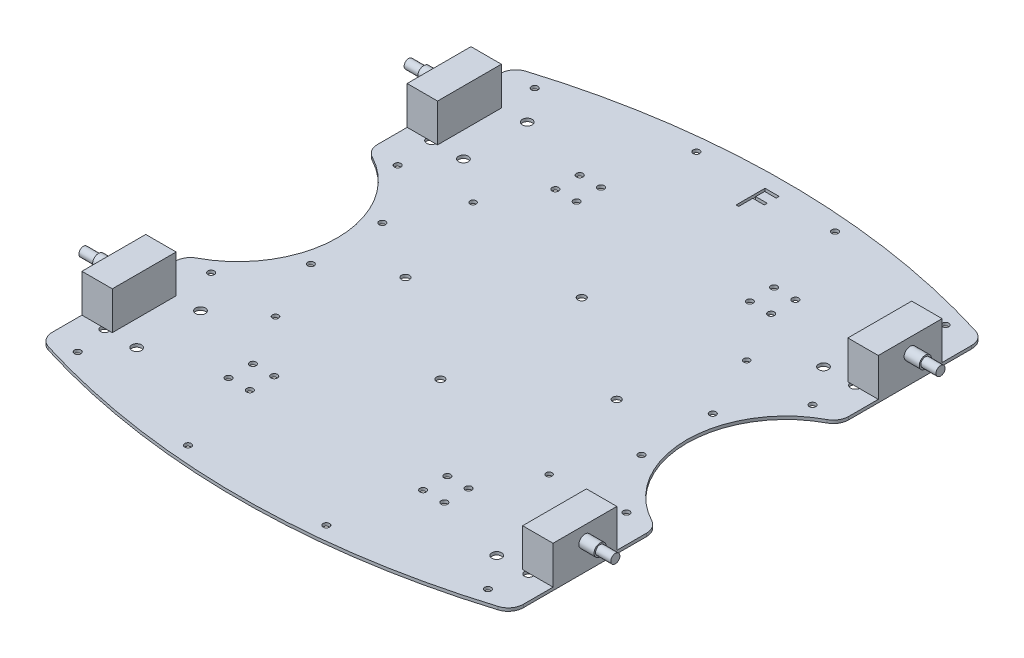
from build123d import *

# Parameters (mm, degrees)
SKETCH1_R           = 2.75
SKETCH1_R_2         = 3.19965974
SKETCH1_R_3         = 2.125
SKETCH1_R_4         = 2.6
SKETCH1_R_5         = 2
BOSS_EXTRUDE1_DEPTH = 2
CUT_EXTRUDE1_DEPTH  = 238.125138886
SKETCH3_R           = 2.125
CUT_EXTRUDE2_DEPTH  = 238.125138886
SKETCH5_W           = 42
SKETCH5_H           = 25
BOSS_EXTRUDE2_DEPTH = 20
BOSS_EXTRUDE3_START = -310
SKETCH5_2_W         = 42
SKETCH5_2_H         = 25
BOSS_EXTRUDE3_DEPTH = 20
SKETCH6_R           = 4
BOSS_EXTRUDE4_DEPTH = 10
SKETCH7_R           = 3
BOSS_EXTRUDE5_DEPTH = 10


with BuildPart() as part:
    # Sketch1 → Boss-Extrude1 (new body)
    with BuildSketch(Plane(origin=(0, 0, 0), x_dir=(1, 0, 0), z_dir=(0, 1, 0))):
        with BuildLine():
            Line((-155, 147.496205723), (-155, 66.522508221))
            ThreePointArc((-155, 66.522508221), (-153.570009292, 61.369359597), (-149.689011853, 57.690001904))
            ThreePointArc((-149.689011853, 57.690001904), (-115, 0), (-149.689011853, -57.690001904))
            ThreePointArc((-149.689011853, -57.690001904), (-153.570009292, -61.369359597), (-155, -66.522508221))
            Line((-155, -66.522508221), (-155, -147.496205723))
            ThreePointArc((-155, -147.496205723), (-153.049591193, -153.429508482), (-147.959183673, -157.048338049))
            ThreePointArc((-147.959183673, -157.048338049), (0, -179.441721715), (147.959183673, -157.048338049))
            ThreePointArc((147.959183673, -157.048338049), (153.049591193, -153.429508482), (155, -147.496205723))
            Line((155, -147.496205723), (155, -66.522508221))
            ThreePointArc((155, -66.522508221), (153.570009292, -61.369359597), (149.689011853, -57.690001904))
            ThreePointArc((149.689011853, -57.690001904), (115, 0), (149.689011853, 57.690001904))
            ThreePointArc((149.689011853, 57.690001904), (153.570009292, 61.369359597), (155, 66.522508221))
            Line((155, 66.522508221), (155, 147.496205723))
            ThreePointArc((155, 147.496205723), (153.049591193, 153.429508482), (147.959183673, 157.048338049))
            ThreePointArc((147.959183673, 157.048338049), (0, 179.441721715), (-147.959183673, 157.048338049))
            ThreePointArc((-147.959183673, 157.048338049), (-153.049591193, 153.429508482), (-155, 147.496205723))
        make_face()
        with Locations(Location((-139.47, 128.51, 0), (0, 0, 270))):
            Circle(SKETCH1_R, mode=Mode.SUBTRACT)
        with Locations(Location((-139.47, 86.51, 0), (0, 0, 270))):
            Circle(SKETCH1_R_2, mode=Mode.SUBTRACT)
        with Locations(Location((139.47, 86.51, 0), (0, 0, 270))):
            Circle(SKETCH1_R_2, mode=Mode.SUBTRACT)
        with Locations(Location((139.47, 128.51, 0), (0, 0, 270))):
            Circle(SKETCH1_R, mode=Mode.SUBTRACT)
        with Locations(Location((139.47, -86.51, 0), (0, 0, 270))):
            Circle(SKETCH1_R_2, mode=Mode.SUBTRACT)
        with Locations(Location((139.47, -128.51, 0), (0, 0, 270))):
            Circle(SKETCH1_R, mode=Mode.SUBTRACT)
        with Locations(Location((-139.47, -86.51, 0), (0, 0, 270))):
            Circle(SKETCH1_R_2, mode=Mode.SUBTRACT)
        with Locations(Location((-139.47, -128.51, 0), (0, 0, 270))):
            Circle(SKETCH1_R, mode=Mode.SUBTRACT)
        with Locations(Location((-70.97, 115.51, 0), (0, 0, 270))):
            Circle(SKETCH1_R_3, mode=Mode.SUBTRACT)
        with Locations(Location((-56.97, 115.51, 0), (0, 0, 270))):
            Circle(SKETCH1_R_3, mode=Mode.SUBTRACT)
        with Locations(Location((-70.97, 99.51, 0), (0, 0, 270))):
            Circle(SKETCH1_R_3, mode=Mode.SUBTRACT)
        with Locations(Location((-56.97, 99.51, 0), (0, 0, 270))):
            Circle(SKETCH1_R_3, mode=Mode.SUBTRACT)
        with Locations(Location((56.97, 99.51, 0), (0, 0, 270))):
            Circle(SKETCH1_R_3, mode=Mode.SUBTRACT)
        with Locations(Location((70.97, 99.51, 0), (0, 0, 270))):
            Circle(SKETCH1_R_3, mode=Mode.SUBTRACT)
        with Locations(Location((56.97, 115.51, 0), (0, 0, 270))):
            Circle(SKETCH1_R_3, mode=Mode.SUBTRACT)
        with Locations(Location((70.97, 115.51, 0), (0, 0, 270))):
            Circle(SKETCH1_R_3, mode=Mode.SUBTRACT)
        with Locations(Location((70.97, -99.51, 0), (0, 0, 270))):
            Circle(SKETCH1_R_3, mode=Mode.SUBTRACT)
        with Locations(Location((56.97, -99.51, 0), (0, 0, 270))):
            Circle(SKETCH1_R_3, mode=Mode.SUBTRACT)
        with Locations(Location((70.97, -115.51, 0), (0, 0, 270))):
            Circle(SKETCH1_R_3, mode=Mode.SUBTRACT)
        with Locations(Location((56.97, -115.51, 0), (0, 0, 270))):
            Circle(SKETCH1_R_3, mode=Mode.SUBTRACT)
        with Locations(Location((-56.97, -99.51, 0), (0, 0, 270))):
            Circle(SKETCH1_R_3, mode=Mode.SUBTRACT)
        with Locations(Location((-70.97, -99.51, 0), (0, 0, 270))):
            Circle(SKETCH1_R_3, mode=Mode.SUBTRACT)
        with Locations(Location((-56.97, -115.51, 0), (0, 0, 270))):
            Circle(SKETCH1_R_3, mode=Mode.SUBTRACT)
        with Locations(Location((-70.97, -115.51, 0), (0, 0, 270))):
            Circle(SKETCH1_R_3, mode=Mode.SUBTRACT)
        with Locations(Location((-118.47, 128.51, 0), (0, 0, 270))):
            Circle(SKETCH1_R_2, mode=Mode.SUBTRACT)
        with Locations(Location((-118.47, 86.51, 0), (0, 0, 270))):
            Circle(SKETCH1_R_2, mode=Mode.SUBTRACT)
        with Locations(Location((118.47, 86.51, 0), (0, 0, 270))):
            Circle(SKETCH1_R_2, mode=Mode.SUBTRACT)
        with Locations(Location((118.47, 128.51, 0), (0, 0, 270))):
            Circle(SKETCH1_R_2, mode=Mode.SUBTRACT)
        with Locations(Location((118.47, -128.51, 0), (0, 0, 270))):
            Circle(SKETCH1_R_2, mode=Mode.SUBTRACT)
        with Locations(Location((118.47, -86.51, 0), (0, 0, 270))):
            Circle(SKETCH1_R_2, mode=Mode.SUBTRACT)
        with Locations(Location((-118.47, -86.51, 0), (0, 0, 270))):
            Circle(SKETCH1_R_2, mode=Mode.SUBTRACT)
        with Locations(Location((-118.47, -128.51, 0), (0, 0, 270))):
            Circle(SKETCH1_R_2, mode=Mode.SUBTRACT)
        with Locations(Location((-0.51, 46.4, 0), (0, 0, 270))):
            Circle(SKETCH1_R_4, mode=Mode.SUBTRACT)
        with Locations(Location((68.99, -0.1, 0), (0, 0, 270))):
            Circle(SKETCH1_R_4, mode=Mode.SUBTRACT)
        with Locations(Location((-0.51, -46.6, 0), (0, 0, 270))):
            Circle(SKETCH1_R_4, mode=Mode.SUBTRACT)
        with Locations(Location((-70.01, -0.1, 0), (0, 0, 270))):
            Circle(SKETCH1_R_4, mode=Mode.SUBTRACT)
        with Locations(Location((-90.51, 64.9, 0), (0, 0, 270))):
            Circle(SKETCH1_R_5, mode=Mode.SUBTRACT)
        with Locations(Location((89.49, 64.9, 0), (0, 0, 270))):
            Circle(SKETCH1_R_5, mode=Mode.SUBTRACT)
        with Locations(Location((89.49, -65.1, 0), (0, 0, 270))):
            Circle(SKETCH1_R_5, mode=Mode.SUBTRACT)
        with Locations(Location((-90.51, -65.1, 0), (0, 0, 270))):
            Circle(SKETCH1_R_5, mode=Mode.SUBTRACT)
    extrude(amount=BOSS_EXTRUDE1_DEPTH)

    # Sketch2 → Cut-Extrude1 (cut, through all)
    with BuildSketch(Plane(origin=(0, 2, 0), x_dir=(1, 0, 0), z_dir=(0, 1, 0))):
        Polygon((-2.557692308, 169.05), (6.723076923, 169.05), (6.723076923, 167.096153846), (-0.848076923, 167.096153846), (-0.848076923, 161.234615385), (6.723076923, 161.234615385), (6.723076923, 159.280769231), (-0.848076923, 159.280769231), (-0.848076923, 150), (-2.557692308, 150), align=None)
    extrude(amount=-CUT_EXTRUDE1_DEPTH, mode=Mode.SUBTRACT)

    # Sketch3 → Cut-Extrude2 (cut, through all)
    with BuildSketch(Plane(origin=(0, 2, 0), x_dir=(1, 0, 0), z_dir=(0, 1, 0))):
        with Locations(Location((-135.418169234, 150.357764594, 0), (0, 0, 270))):
            Circle(SKETCH3_R)
        with Locations(Location((-45.914062128, 167.285855531, 0), (0, 0, 270))):
            Circle(SKETCH3_R)
        with Locations(Location((45.176775579, 167.354684187, 0), (0, 0, 270))):
            Circle(SKETCH3_R)
        with Locations(Location((134.706362354, 150.561871932, 0), (0, 0, 270))):
            Circle(SKETCH3_R)
        with Locations(Location((134.706362354, -150.561871932, 0), (0, 0, 90))):
            Circle(SKETCH3_R)
        with Locations(Location((45.176775579, -167.354684187, 0), (0, 0, 90))):
            Circle(SKETCH3_R)
        with Locations(Location((-45.914062128, -167.285855531, 0), (0, 0, 90))):
            Circle(SKETCH3_R)
        with Locations(Location((-135.418169234, -150.357764594, 0), (0, 0, 90))):
            Circle(SKETCH3_R)
        with Locations(Location((-136.498269922, 61.257473969, 0), (0, 0, 270))):
            Circle(SKETCH3_R)
        with Locations(Location((-108.723114922, 23.387075934, 0), (0, 0, 270))):
            Circle(SKETCH3_R)
        with Locations(Location((-108.785429276, -23.5769784, 0), (0, 0, 270))):
            Circle(SKETCH3_R)
        with Locations(Location((-136.660983133, -61.373536175, 0), (0, 0, 270))):
            Circle(SKETCH3_R)
        with Locations(Location((136.660983133, -61.373536175, 0), (0, 0, 90))):
            Circle(SKETCH3_R)
        with Locations(Location((108.785429276, -23.5769784, 0), (0, 0, 90))):
            Circle(SKETCH3_R)
        with Locations(Location((108.723114922, 23.387075934, 0), (0, 0, 90))):
            Circle(SKETCH3_R)
        with Locations(Location((136.498269922, 61.257473969, 0), (0, 0, 90))):
            Circle(SKETCH3_R)
    extrude(amount=-CUT_EXTRUDE2_DEPTH, mode=Mode.SUBTRACT)

    # Sketch5 → Boss-Extrude2 (add)
    with BuildSketch(Plane.ZY.offset(155)):
        with Locations((-107.009356972, 14.5)):
            Rectangle(SKETCH5_W, SKETCH5_H)
        with Locations((107.009356972, 14.5)):
            Rectangle(SKETCH5_W, SKETCH5_H)
    extrude(amount=-BOSS_EXTRUDE2_DEPTH)

    # Sketch5<2> → Boss-Extrude3 (add)
    with BuildSketch(Plane.ZY.offset(155).offset(BOSS_EXTRUDE3_START)):
        with Locations((-107.009356972, 14.5)):
            Rectangle(SKETCH5_2_W, SKETCH5_2_H)
        with Locations((107.009356972, 14.5)):
            Rectangle(SKETCH5_2_W, SKETCH5_2_H)
    extrude(amount=BOSS_EXTRUDE3_DEPTH)

    # Sketch6 → Boss-Extrude4 (add)
    with BuildSketch(Plane.ZY.offset(155)):
        with Locations(Location((107.009356972, 17.75, 0), (0, 0, 180))):
            Circle(SKETCH6_R)
        with Locations(Location((-107.009356972, 17.75, 0), (0, 0, 180))):
            Circle(SKETCH6_R)
    boss_extrude4 = extrude(amount=BOSS_EXTRUDE4_DEPTH)

    # Sketch7 → Boss-Extrude5 (add)
    with BuildSketch(Plane.ZY.offset(165)):
        with Locations((107.009356972, 17.75)):
            Circle(SKETCH7_R)
        with Locations((-107.009356972, 17.75)):
            Circle(SKETCH7_R)
    boss_extrude5 = extrude(amount=BOSS_EXTRUDE5_DEPTH)

    # Mirror1: Boss-Extrude4, Boss-Extrude5 across plane
    add(boss_extrude4.mirror(Plane.ZY))
    add(boss_extrude5.mirror(Plane.ZY))


solid = part.part
